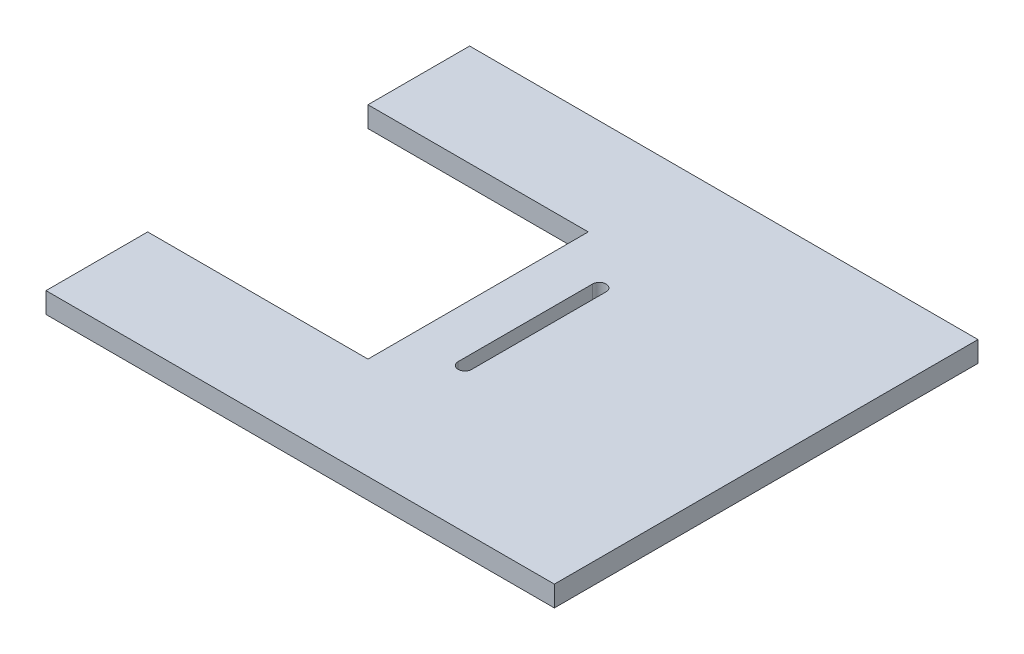
from build123d import *

# Parameters (mm, degrees)
BOSS_EXTRUDE2_DEPTH = 12.2
CUT_EXTRUDE1_DEPTH  = 30


with BuildPart() as part:
    # Sketch1 → Boss-Extrude2 (new body)
    with BuildSketch(Plane(origin=(0, 0, 0), x_dir=(1, 0, 0), z_dir=(0, 1, 0))):
        Polygon((150, 125), (-150, 125), (-150, 65), (-20, 65), (-20, -65), (-150, -65), (-150, -125), (150, -125), align=None)
    extrude(amount=BOSS_EXTRUDE2_DEPTH)

    # Sketch2 → Cut-Extrude1 (cut)
    with BuildSketch(Plane(origin=(0, 12.2, 0), x_dir=(1, 0, 0), z_dir=(0, 1, 0))):
        with BuildLine():
            Line((15.884395788, 39.654803454), (15.884395788, -39.654803454))
            ThreePointArc((15.884395788, -39.654803454), (11.884395788, -43.654803454), (7.884395788, -39.654803454))
            Line((7.884395788, -39.654803454), (7.884395788, 39.654803454))
            ThreePointArc((7.884395788, 39.654803454), (11.884395788, 43.654803454), (15.884395788, 39.654803454))
        make_face()
    extrude(amount=-CUT_EXTRUDE1_DEPTH, mode=Mode.SUBTRACT)


solid = part.part
